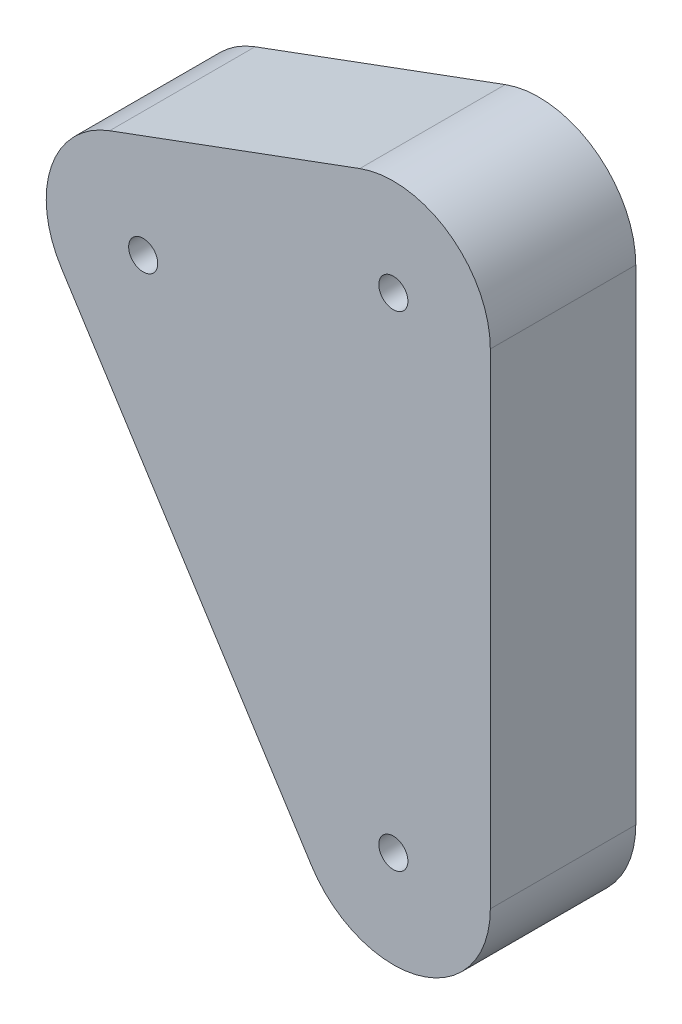
from build123d import *

# Parameters (mm, degrees)
SKETCH1_R           = 1.5
BOSS_EXTRUDE1_DEPTH = 15


with BuildPart() as part:
    # Sketch1 → Boss-Extrude1 (new body)
    with BuildSketch(Plane.XY):
        with BuildLine():
            Line((-29.261409288, 49.858838915), (-3.462727273, 59.381338915))
            ThreePointArc((-3.462727273, 59.381338915), (5.717198933, 58.204488794), (10, 50))
            Line((10, 50), (10, 0))
            ThreePointArc((10, 0), (2.79927446, -9.600211586), (-8.4328125, -5.37472542))
            Line((-8.4328125, -5.37472542), (-34.231494516, 35.10277458))
            ThreePointArc((-34.231494516, 35.10277458), (-35.275565749, 43.66947035), (-29.261409288, 49.858838915))
        make_face()
        with Locations((-25.798682016, 40.4775)):
            Circle(SKETCH1_R, mode=Mode.SUBTRACT)
        with Locations((0, 50)):
            Circle(SKETCH1_R, mode=Mode.SUBTRACT)
        Circle(SKETCH1_R, mode=Mode.SUBTRACT)
    extrude(amount=BOSS_EXTRUDE1_DEPTH)


solid = part.part
